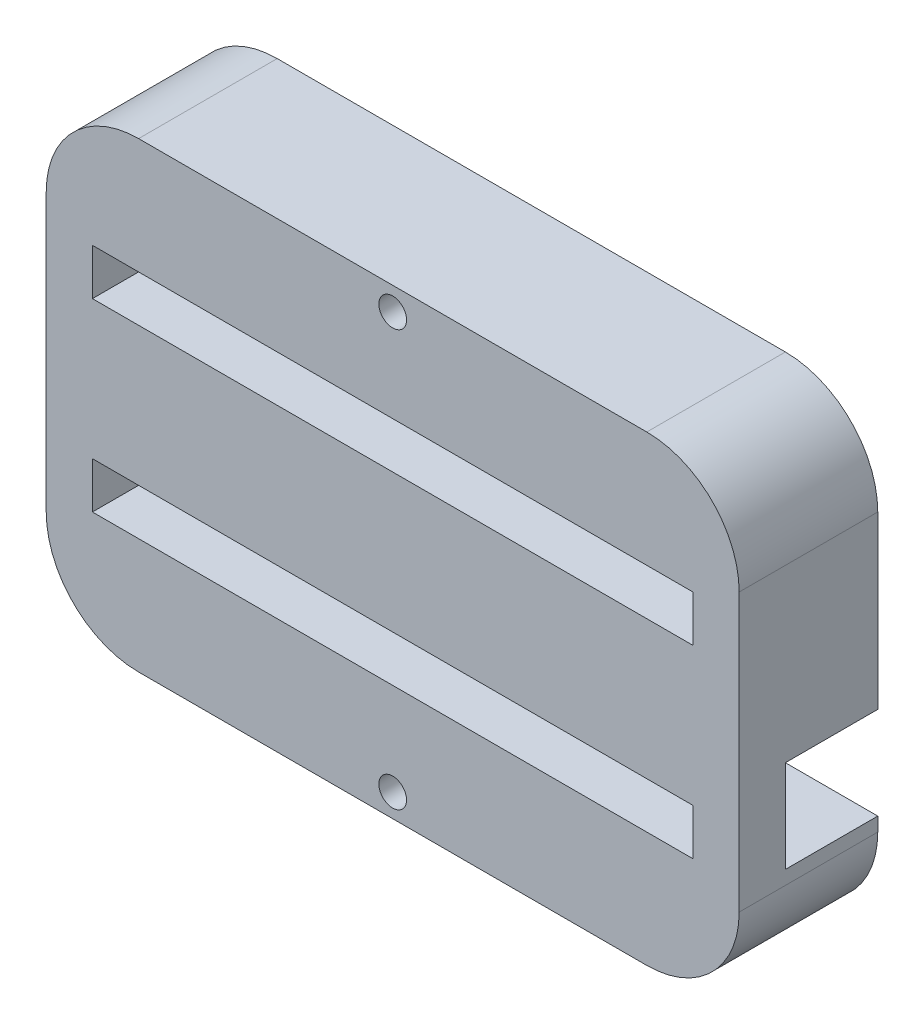
from build123d import *

# Parameters (mm, degrees)
SKETCH1_R           = 1.5
SKETCH1_W           = 65
SKETCH1_H           = 5
BOSS_EXTRUDE1_DEPTH = 15
CUT_EXTRUDE1_REACH  = 93.378
SKETCH2_W           = 10
SKETCH2_H           = 10
SKETCH3_W           = 35
SKETCH3_H           = 15
CUT_EXTRUDE2_DEPTH  = 10
SKETCH4_R           = 1.722798044
CUT_EXTRUDE3_DEPTH  = 0.5
SKETCH5_W           = 5
SKETCH5_H           = 10
BOSS_EXTRUDE2_DEPTH = 10


with BuildPart() as part:
    # Sketch1 → Boss-Extrude1 (new body)
    with BuildSketch(Plane.XY):
        with BuildLine():
            Line((10, 0), (65, 0))
            ThreePointArc((65, 0), (72.071067812, 2.928932188), (75, 10))
            Line((75, 10), (75, 40))
            ThreePointArc((75, 40), (72.071067812, 47.071067812), (65, 50))
            Line((65, 50), (10, 50))
            ThreePointArc((10, 50), (2.928932188, 47.071067812), (0, 40))
            Line((0, 40), (0, 10))
            ThreePointArc((0, 10), (2.928932188, 2.928932188), (10, 0))
        make_face()
        with Locations((37.5, 47.5)):
            Circle(SKETCH1_R, mode=Mode.SUBTRACT)
        with Locations((37.5, 2.5)):
            Circle(SKETCH1_R, mode=Mode.SUBTRACT)
        with Locations((37.5, 35)):
            Rectangle(SKETCH1_W, SKETCH1_H, mode=Mode.SUBTRACT)
        with Locations((37.5, 15)):
            Rectangle(SKETCH1_W, SKETCH1_H, mode=Mode.SUBTRACT)
    extrude(amount=BOSS_EXTRUDE1_DEPTH)

    # Cut-Extrude1: up to this face of the body (flat: up to its plane)
    cut_extrude1_end = Plane(part.part.faces().sort_by_distance((75, 25, 7.5))[0])
    # Sketch2 → Cut-Extrude1 (cut, up to the picked face)
    with BuildSketch(Plane.ZY, mode=Mode.PRIVATE) as cut_extrude1_sk1:
        with Locations((5, 33.5)):
            Rectangle(SKETCH2_W, SKETCH2_H)
    cut_extrude1_tool1 = split(extrude(cut_extrude1_sk1.sketch, amount=-CUT_EXTRUDE1_REACH, mode=Mode.PRIVATE), bisect_by=cut_extrude1_end, keep=Keep.BOTH, mode=Mode.PRIVATE)
    # Sketch2 → Cut-Extrude1 (cut, up to the picked face)
    with BuildSketch(Plane.ZY, mode=Mode.PRIVATE) as cut_extrude1_sk2:
        with Locations((5, 16.5)):
            Rectangle(SKETCH2_W, SKETCH2_H)
    cut_extrude1_tool2 = split(extrude(cut_extrude1_sk2.sketch, amount=-CUT_EXTRUDE1_REACH, mode=Mode.PRIVATE), bisect_by=cut_extrude1_end, keep=Keep.BOTH, mode=Mode.PRIVATE)
    add(cut_extrude1_tool1.solids().sort_by(Axis((0, 33.5, 5), (1, 0, 0)))[0], mode=Mode.SUBTRACT)
    add(cut_extrude1_tool2.solids().sort_by(Axis((0, 16.5, 5), (1, 0, 0)))[0], mode=Mode.SUBTRACT)

    # Sketch3 → Cut-Extrude2 (cut)
    with BuildSketch(Plane(origin=(0, 0, 0), x_dir=(-1, 0, 0), z_dir=(0, 0, -1))):
        with Locations((-37.5, 25)):
            Rectangle(SKETCH3_W, SKETCH3_H)
    extrude(amount=-CUT_EXTRUDE2_DEPTH, mode=Mode.SUBTRACT)

    # Sketch4 → Cut-Extrude3 (cut)
    with BuildSketch(Plane(origin=(0, 0, 10), x_dir=(-1, 0, 0), z_dir=(0, 0, -1))):
        with Locations(Location((-37.5, 25, 0), (0, 0, 90))):
            Circle(SKETCH4_R)
    extrude(amount=-CUT_EXTRUDE3_DEPTH, mode=Mode.SUBTRACT)

    # Sketch5 → Boss-Extrude2 (add)
    with BuildSketch(Plane(origin=(0, 0, 10), x_dir=(-1, 0, 0), z_dir=(0, 0, -1))):
        with Locations((-72.5, 33.5)):
            Rectangle(SKETCH5_W, SKETCH5_H)
        with Locations((-2.5, 16.5)):
            Rectangle(SKETCH5_W, SKETCH5_H)
    extrude(amount=BOSS_EXTRUDE2_DEPTH)


solid = part.part
